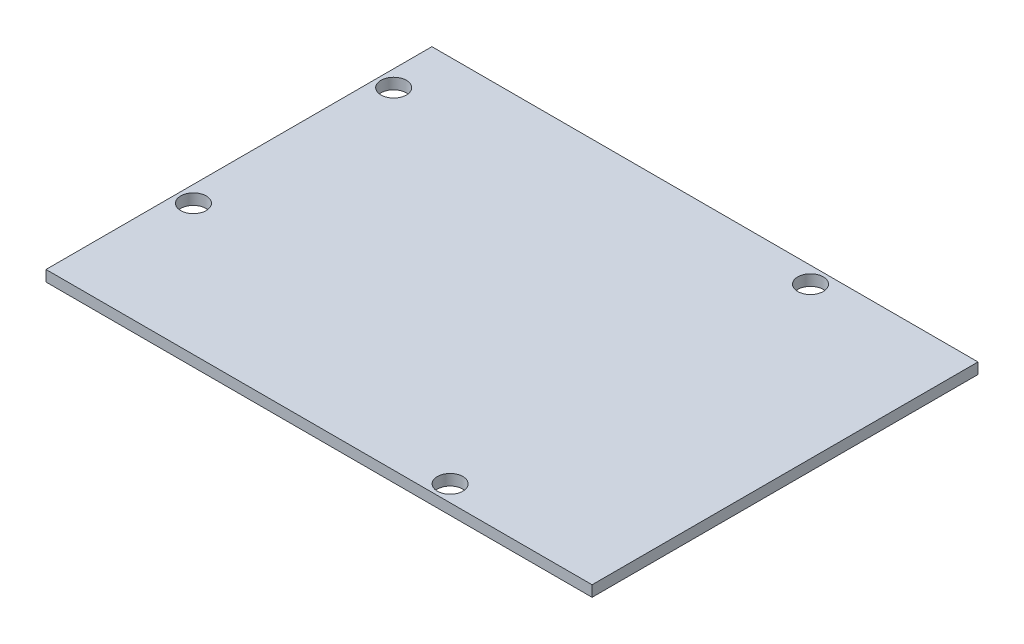
from build123d import *

# Parameters (mm, degrees)
SKETCH1_W           = 75
SKETCH1_H           = 53
SKETCH1_R           = 1.75
BOSS_EXTRUDE1_DEPTH = 1.5


with BuildPart() as part:
    # Sketch1 → Boss-Extrude1 (new body)
    with BuildSketch(Plane(origin=(0, 0, 0), x_dir=(1, 0, 0), z_dir=(0, 1, 0))):
        Rectangle(SKETCH1_W, SKETCH1_H)
        with Locations(Location((-35.25, 19, 0), (0, 0, 270))):
            Circle(SKETCH1_R, mode=Mode.SUBTRACT)
        with Locations(Location((-35.25, -8.5, 0), (0, 0, 270))):
            Circle(SKETCH1_R, mode=Mode.SUBTRACT)
        with Locations(Location((15.75, -24.25, 0), (0, 0, 270))):
            Circle(SKETCH1_R, mode=Mode.SUBTRACT)
        with Locations(Location((16.75, 24.25, 0), (0, 0, 270))):
            Circle(SKETCH1_R, mode=Mode.SUBTRACT)
    extrude(amount=BOSS_EXTRUDE1_DEPTH)


solid = part.part
